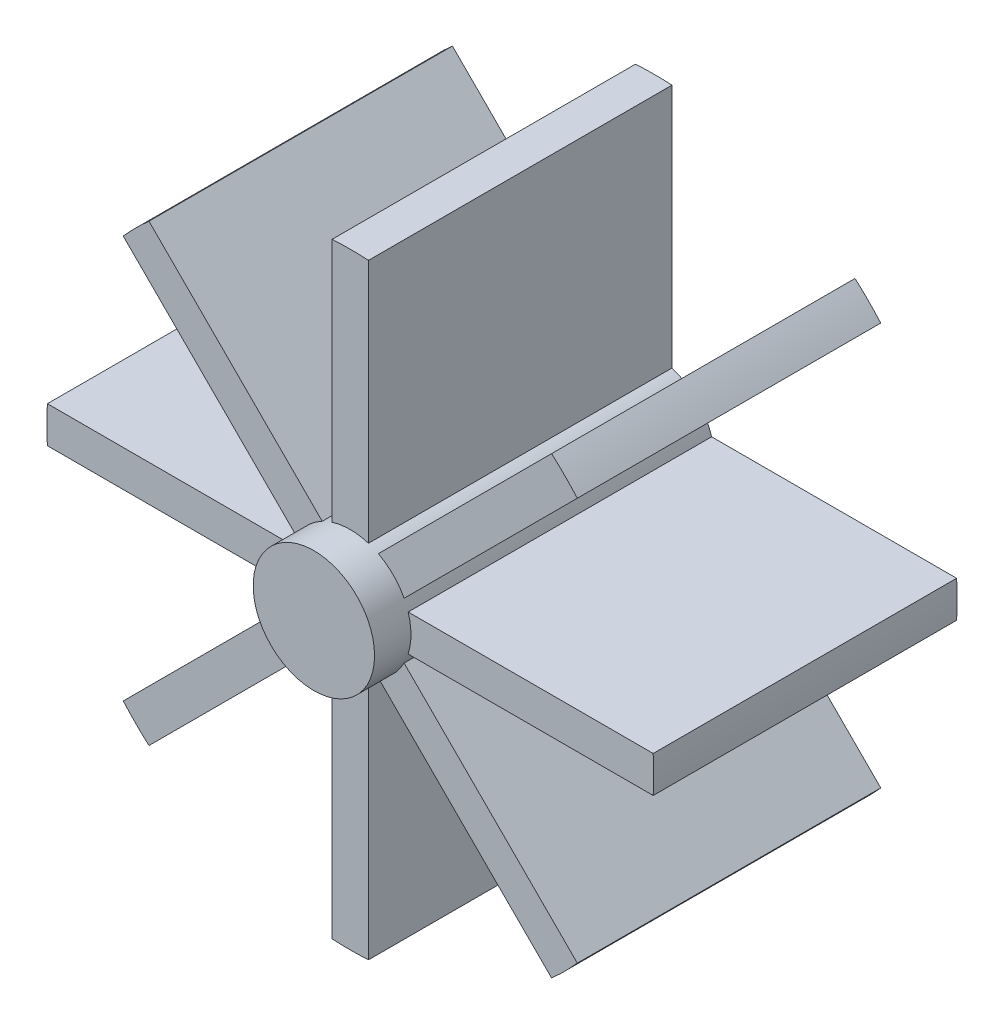
from build123d import *

# Parameters (mm, degrees)
BOSS_EXTRUDE1_DEPTH = 50
SKETCH2_R           = 10
BOSS_EXTRUDE3_DEPTH = 6
BOSS_EXTRUDE4_START = -50
SKETCH2_2_R         = 10
BOSS_EXTRUDE4_DEPTH = 50


with BuildPart() as part:
    # Sketch1 → Boss-Extrude1 (new body)
    with BuildSketch(Plane.XY):
        with BuildLine():
            ThreePointArc((3, 49.909918854), (0, 50), (-3, 49.909918854))
            Line((-3, 49.909918854), (-3, 7.242640687))
            Line((-3, 7.242640687), (-33.170321726, 37.412962414))
            ThreePointArc((-33.170321726, 37.412962414), (-35.355339059, 35.355339059), (-37.412962414, 33.170321726))
            Line((-37.412962414, 33.170321726), (-7.242640687, 3))
            Line((-7.242640687, 3), (-49.909918854, 3))
            ThreePointArc((-49.909918854, 3), (-50, 0), (-49.909918854, -3))
            Line((-49.909918854, -3), (-7.242640687, -3))
            Line((-7.242640687, -3), (-37.412962414, -33.170321726))
            ThreePointArc((-37.412962414, -33.170321726), (-35.355339059, -35.355339059), (-33.170321726, -37.412962414))
            Line((-33.170321726, -37.412962414), (-3, -7.242640687))
            Line((-3, -7.242640687), (-3, -49.909918854))
            ThreePointArc((-3, -49.909918854), (0, -50), (3, -49.909918854))
            Line((3, -49.909918854), (3, -7.242640687))
            Line((3, -7.242640687), (33.170321726, -37.412962414))
            ThreePointArc((33.170321726, -37.412962414), (35.355339059, -35.355339059), (37.412962414, -33.170321726))
            Line((37.412962414, -33.170321726), (7.242640687, -3))
            Line((7.242640687, -3), (49.909918854, -3))
            ThreePointArc((49.909918854, -3), (49.97747464, -1.500676065), (50, 0))
            ThreePointArc((50, 0), (49.97747464, 1.500676065), (49.909918854, 3))
            Line((49.909918854, 3), (7.242640687, 3))
            Line((7.242640687, 3), (37.412962414, 33.170321726))
            ThreePointArc((37.412962414, 33.170321726), (35.355339059, 35.355339059), (33.170321726, 37.412962414))
            Line((33.170321726, 37.412962414), (3, 7.242640687))
            Line((3, 7.242640687), (3, 49.909918854))
        make_face()
    extrude(amount=BOSS_EXTRUDE1_DEPTH)

    # Sketch2 → Boss-Extrude3 (add)
    with BuildSketch(Plane.XY.offset(50)):
        Circle(SKETCH2_R)
    extrude(amount=BOSS_EXTRUDE3_DEPTH)

    # Sketch2<2> → Boss-Extrude4 (add)
    with BuildSketch(Plane.XY.offset(50).offset(BOSS_EXTRUDE4_START)):
        Circle(SKETCH2_2_R)
    extrude(amount=BOSS_EXTRUDE4_DEPTH)


solid = part.part
